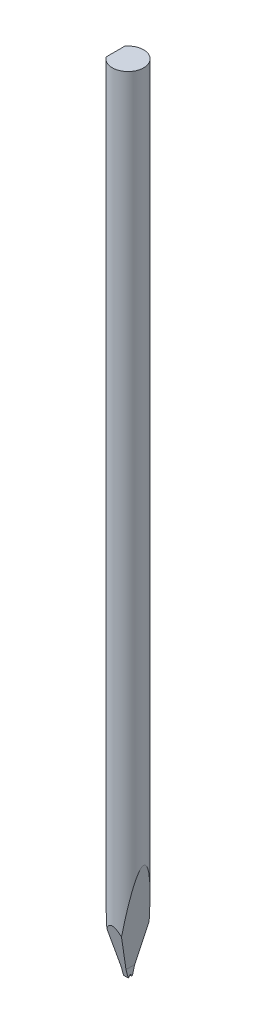
from build123d import *

# Parameters (mm, degrees)
SKETCH_TL_CUTTING_R    = 1.4986
TL_CUTTING_DEPTH       = 75.9968
SKETCH_TDF_CUTTING_W   = 3.01719996
SKETCH_TDF_CUTTING_H   = 3.01719996
TDF_CUTTING_DEPTH      = 77.026345527
VW_VR_GRINDING_DEPTH   = 1.50859998
VW_VR_GRINDING_2_DEPTH = 1.50859998
ISA_GRINDING_DEPTH     = 1.50859998
SKETCH_PRE_FRX_BRX_W   = 1.26508002
SKETCH_PRE_FRX_BRX_H   = 0.8001
SKETCH_PRE_FRX_BRX_W_2 = 1.29253996
PRE_FRX_BRX_DEPTH      = 1.50859998
FA_BA_GRINDING_DEPTH   = 1.50859998
BR_EDM_R               = 0.06096
FR_EDM_R               = 0.06096


with BuildPart() as part:
    # sketch_TL_cutting → TL_cutting (new body)
    with BuildSketch(Plane(origin=(0, 0, 0), x_dir=(1, 0, 0), z_dir=(0, 1, 0))):
        with Locations(Location((0, 0, 0), (0, 0, 270))):
            Circle(SKETCH_TL_CUTTING_R)
    extrude(amount=TL_CUTTING_DEPTH)

    # sketch_TDF_cutting → TDF_cutting (cut, through all)
    with BuildSketch(Plane(origin=(0, 0, 0), x_dir=(1, 0, 0), z_dir=(0, 1, 0))):
        with Locations((-2.71001998, 0)):
            Rectangle(SKETCH_TDF_CUTTING_W, SKETCH_TDF_CUTTING_H)
    extrude(amount=TDF_CUTTING_DEPTH, mode=Mode.SUBTRACT)


with BuildPart() as body_2:
    # sketch_VW_VR_grinding → VW_VR_grinding (new, symmetric)
    with BuildSketch(Plane(origin=(0, 0, 0), x_dir=(0, 0, -1), z_dir=(1, 0, 0))):
        with BuildLine():
            Line((-1.49360001, -0.00999998), (-1.49360001, 0.788988914))
            ThreePointArc((-1.49360001, 0.788988914), (-1.493648337, 0.790095792), (-1.493792952, 0.791194246))
            Line((-1.493792952, 0.791194246), (-1.51859996, 0.931881782))
            Line((-1.51859996, 0.931881782), (-1.50859998, -0.00999998))
            Line((-1.50859998, -0.00999998), (-1.49360001, -0.00999998))
        make_face()
    extrude(amount=VW_VR_GRINDING_DEPTH, both=True)


with BuildPart() as body_3:
    # sketch_VW_VR_grinding → VW_VR_grinding 2 (new, symmetric)
    with BuildSketch(Plane(origin=(0, 0, 0), x_dir=(0, 0, -1), z_dir=(1, 0, 0))):
        with BuildLine():
            Line((1.49360001, -0.00999998), (1.49360001, 0.788988914))
            ThreePointArc((1.49360001, 0.788988914), (1.493648337, 0.790095792), (1.493792952, 0.791194246))
            Line((1.493792952, 0.791194246), (1.51859996, 0.931881782))
            Line((1.51859996, 0.931881782), (1.50859998, -0.00999998))
            Line((1.50859998, -0.00999998), (1.49360001, -0.00999998))
        make_face()
    extrude(amount=VW_VR_GRINDING_2_DEPTH, both=True)


    add(body_2.part)  # ISA_grinding merges body 2
    # sketch_ISA_grinding → ISA_grinding (add, symmetric)
    with BuildSketch(Plane(origin=(0, 0, 0), x_dir=(0, 0, -1), z_dir=(1, 0, 0))):
        Polygon((-0.19939, 0), (0.19939, 0), (1.50859998, 4.886038163), (1.50859998, -0.02999994), (-1.50859998, -0.02999994), (-1.50859998, 4.886038163), align=None)
    extrude(amount=ISA_GRINDING_DEPTH, both=True)

    # sketch_pre_FRX_BRX → pre_FRX_BRX (add, symmetric)
    with BuildSketch(Plane.XY):
        with Locations((0.86605999, 0.39005002)):
            Rectangle(SKETCH_PRE_FRX_BRX_W, SKETCH_PRE_FRX_BRX_H)
        with Locations((-0.87232998, 0.39005002)):
            Rectangle(SKETCH_PRE_FRX_BRX_W_2, SKETCH_PRE_FRX_BRX_H)
    extrude(amount=PRE_FRX_BRX_DEPTH, both=True)

    # sketch_FA_BA_grinding → FA_BA_grinding (add, symmetric)
    with BuildSketch(Plane.XY):
        Polygon((0.22352, -0.00999998), (0.22352, 0.8001), (1.6256, 10.77641758), (1.6256, -0.00999998), align=None)
        Polygon((-0.22606, -0.00999998), (-0.22606, 0.8001), (-1.32842, 8.643798967), (-1.32842, -0.00999998), align=None)
    extrude(amount=FA_BA_GRINDING_DEPTH, both=True)


with BuildPart() as part_1:
    add(part.part)

    # B1_fix: cut body 3
    add(body_3.part, mode=Mode.SUBTRACT)

    # V-Groove_EDM: sweep along a path in sketch_contour_V-Groove
    with BuildLine(Plane.XY) as v_groove_edm_path:
        Line((-1.20142, 0.127), (1.4986, 0.127))
    # sketch_section_V-Groove → V-Groove_EDM (sweep, cut)
    with BuildSketch(Plane(origin=(-1.20142, 0, -1.2954), x_dir=(0, 0, -1), z_dir=(1, 0, 0))):
        with BuildLine():
            Line((-1.262109661, 0.109670146), (-1.178315736, -0.00999998))
            Line((-1.178315736, -0.00999998), (-1.412484264, -0.00999998))
            Line((-1.412484264, -0.00999998), (-1.328690339, 0.109670146))
            ThreePointArc((-1.328690339, 0.109670146), (-1.2954, 0.127), (-1.262109661, 0.109670146))
        make_face()
    sweep(path=v_groove_edm_path.line, mode=Mode.SUBTRACT)

    # BR_EDM
    br_edm_edges = [part_1.edges().sort_by_distance(p)[0] for p in [
        (-0.22606, 0.127, 0),
        (-0.22606, 0.054835073, -0.071686271),
        (-0.22606, 0.054835073, 0.071686271),
    ]]
    fillet(br_edm_edges, radius=BR_EDM_R)

    # FR_EDM
    fr_edm_edges = [part_1.edges().sort_by_distance(p)[0] for p in [
        (0.22352, 0.054835073, -0.071686271),
        (0.22352, 0.054835073, 0.071686271),
        (0.22352, 0.127, 0),
    ]]
    fillet(fr_edm_edges, radius=FR_EDM_R)


solid = part_1.part
